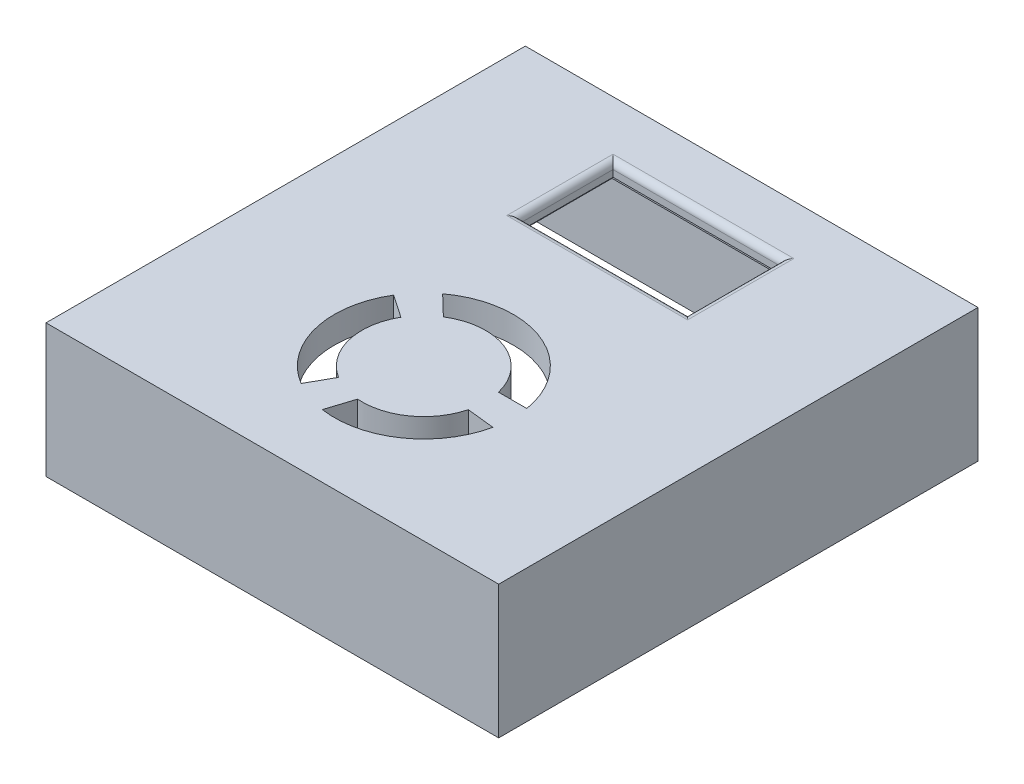
from build123d import *

# Parameters (mm, degrees)
SKETCH_1_W                 = 34
SKETCH_1_H                 = 36
EXTRUDE_1_DEPTH            = 10
SHELL_1_T                  = -1
SHELL_1_THICKNESS_2_FACE_W = 34
SHELL_1_THICKNESS_2_FACE_H = 32
SHELL_1_THICKNESS_2_DEPTH  = 1
CUT_EXTRUDE_START          = 8
SKETCH_2_W                 = 12.58
SKETCH_2_H                 = 6.98
CUT_EXTRUDE_1_DEPTH        = 5.0005
SKETCH_6_W                 = 14.7
SKETCH_6_H                 = 11.8
CUT_EXTRUDE_2_DEPTH        = 1
FILLET_2_R                 = 0.5
CUT_EXTRUDE_START_2        = 10
CUT_EXTRUDE_3_DEPTH        = 2
CUT_EXTRUDE_START_3        = -16
CUT_EXTRUDE_4_DEPTH        = 1
CUT_EXTRUDE_START_4        = 17
SKETCH_13_W                = 9.193413451
SKETCH_13_H                = 1.5
CUT_EXTRUDE_5_DEPTH        = 0.5


with BuildPart() as part:
    # 草图1 → 凸台-拉伸1 (new body)
    with BuildSketch(Plane(origin=(0, 0, 0), x_dir=(1, 0, 0), z_dir=(0, 1, 0))):
        Rectangle(SKETCH_1_W, SKETCH_1_H)
    extrude(amount=EXTRUDE_1_DEPTH)

    # 抽壳1
    shell_1_openings = [part.faces().sort_by_distance(p)[0] for p in [
        (0, 0, 0),
    ]]
    offset(amount=SHELL_1_T, openings=shell_1_openings, kind=Kind.INTERSECTION)

    # 抽壳1 thickness 2 face (on inner face of the shell) → 抽壳1 thickness 2 (add)
    with BuildSketch(Plane.ZX.offset(9)):
        Rectangle(SHELL_1_THICKNESS_2_FACE_W, SHELL_1_THICKNESS_2_FACE_H)
    extrude(amount=-SHELL_1_THICKNESS_2_DEPTH)

    # 草图2 → 切除-拉伸1 (cut, symmetric)
    with BuildSketch(Plane(origin=(0, 0, 0), x_dir=(1, 0, 0), z_dir=(0, 1, 0)).offset(CUT_EXTRUDE_START)):
        with Locations((0.114253814, 10.274424553)):
            Rectangle(SKETCH_2_W, SKETCH_2_H)
    extrude(amount=CUT_EXTRUDE_1_DEPTH, both=True, mode=Mode.SUBTRACT)

    # 草图6 → 切除-拉伸2 (cut, symmetric)
    with BuildSketch(Plane(origin=(0, 0, 0), x_dir=(1, 0, 0), z_dir=(0, 1, 0)).offset(CUT_EXTRUDE_START)):
        with Locations((0.212081247, 8.751285152)):
            Rectangle(SKETCH_6_W, SKETCH_6_H)
    extrude(amount=CUT_EXTRUDE_2_DEPTH, both=True, mode=Mode.SUBTRACT)

    # 圆角2
    fillet_2_edges = [part.edges().sort_by_distance(p)[0] for p in [
        (6.404253814, 10, -10.274424553),
        (0.114253814, 10, -6.784424553),
        (-6.175746186, 10, -10.274424553),
        (0.114253814, 10, -13.764424553),
    ]]
    fillet(fillet_2_edges, radius=FILLET_2_R)

    # 草图10 → 切除-拉伸3 (cut)
    with BuildSketch(Plane(origin=(0, 0, 0), x_dir=(1, 0, 0), z_dir=(0, 1, 0)).offset(CUT_EXTRUDE_START_2)):
        with BuildLine():
            Line((-3.993743906, -1.215281594), (-2.463768403, -2.690446502))
            ThreePointArc((-2.463768403, -2.690446502), (1.744606129, -2.322550765), (4.505547025, -5.519888538))
            Line((4.505547025, -5.519888538), (6.628721392, -5.515926654))
            ThreePointArc((6.628721392, -5.515926654), (2.52183734, -0.390898934), (-3.993743906, -1.215281594))
        make_face()
        with BuildLine():
            Line((-5.750245846, -3.142252551), (-4.035268841, -4.309111683))
            ThreePointArc((-4.035268841, -4.309111683), (-4.509884123, -7.752654512), (-2.464252289, -10.56310595))
            Line((-2.464252289, -10.56310595), (-3.477509556, -12.370007953))
            ThreePointArc((-3.477509556, -12.370007953), (-6.52500842, -8.22682935), (-5.750245846, -3.142252551))
        make_face()
        with BuildLine():
            Line((-0.33755867, -11.264535632), (-0.979652593, -13.267970949))
            ThreePointArc((-0.979652593, -13.267970949), (3.836702752, -12.136836694), (6.57348953, -8.015339194))
            Line((6.57348953, -8.015339194), (4.50812982, -7.787936955))
            ThreePointArc((4.50812982, -7.787936955), (2.714792905, -10.403644562), (-0.33755867, -11.264535632))
        make_face()
    extrude(amount=-CUT_EXTRUDE_3_DEPTH, mode=Mode.SUBTRACT)

    # 草图11 → 切除-拉伸4 (cut)
    with BuildSketch(Plane(origin=(0, 0, 0), x_dir=(0, 0, -1), z_dir=(1, 0, 0)).offset(CUT_EXTRUDE_START_3)):
        with BuildLine():
            Line((13.165354419, 7.763482474), (12.615354419, 7.763482474))
            ThreePointArc((12.615354419, 7.763482474), (12.261801028, 7.617035865), (12.115354419, 7.263482474))
            Line((12.115354419, 7.263482474), (12.115354419, 2.663482474))
            ThreePointArc((12.115354419, 2.663482474), (12.261801028, 2.309929083), (12.615354419, 2.163482474))
            Line((12.615354419, 2.163482474), (13.165354419, 2.163482474))
            ThreePointArc((13.165354419, 2.163482474), (13.518907809, 2.309929083), (13.665354419, 2.663482474))
            Line((13.665354419, 2.663482474), (13.665354419, 7.263482474))
            ThreePointArc((13.665354419, 7.263482474), (13.518907809, 7.617035865), (13.165354419, 7.763482474))
        make_face()
        with BuildLine():
            Line((15.855458394, 7.745816392), (15.305458394, 7.745816392))
            ThreePointArc((15.305458394, 7.745816392), (14.951905004, 7.599369782), (14.805458394, 7.245816392))
            Line((14.805458394, 7.245816392), (14.805458394, 2.645816392))
            ThreePointArc((14.805458394, 2.645816392), (14.951905004, 2.292263001), (15.305458394, 2.145816392))
            Line((15.305458394, 2.145816392), (15.855458394, 2.145816392))
            ThreePointArc((15.855458394, 2.145816392), (16.209011785, 2.292263001), (16.355458394, 2.645816392))
            Line((16.355458394, 2.645816392), (16.355458394, 7.245816392))
            ThreePointArc((16.355458394, 7.245816392), (16.209011785, 7.599369782), (15.855458394, 7.745816392))
        make_face()
        with BuildLine():
            Line((10.524610149, 7.763448499), (9.974610149, 7.763448499))
            ThreePointArc((9.974610149, 7.763448499), (9.621056758, 7.617001889), (9.474610149, 7.263448499))
            Line((9.474610149, 7.263448499), (9.474610149, 2.663448499))
            ThreePointArc((9.474610149, 2.663448499), (9.621056758, 2.309895108), (9.974610149, 2.163448499))
            Line((9.974610149, 2.163448499), (10.524610149, 2.163448499))
            ThreePointArc((10.524610149, 2.163448499), (10.878163539, 2.309895108), (11.024610149, 2.663448499))
            Line((11.024610149, 2.663448499), (11.024610149, 7.263448499))
            ThreePointArc((11.024610149, 7.263448499), (10.878163539, 7.617001889), (10.524610149, 7.763448499))
        make_face()
    extrude(amount=-CUT_EXTRUDE_4_DEPTH, mode=Mode.SUBTRACT)

    # 草图13 → 切除-拉伸5 (cut)
    with BuildSketch(Plane.XY.offset(CUT_EXTRUDE_START_4)):
        with Locations((9.633284571, 0.749986932)):
            Rectangle(SKETCH_13_W, SKETCH_13_H)
    extrude(amount=CUT_EXTRUDE_5_DEPTH, mode=Mode.SUBTRACT)


solid = part.part
